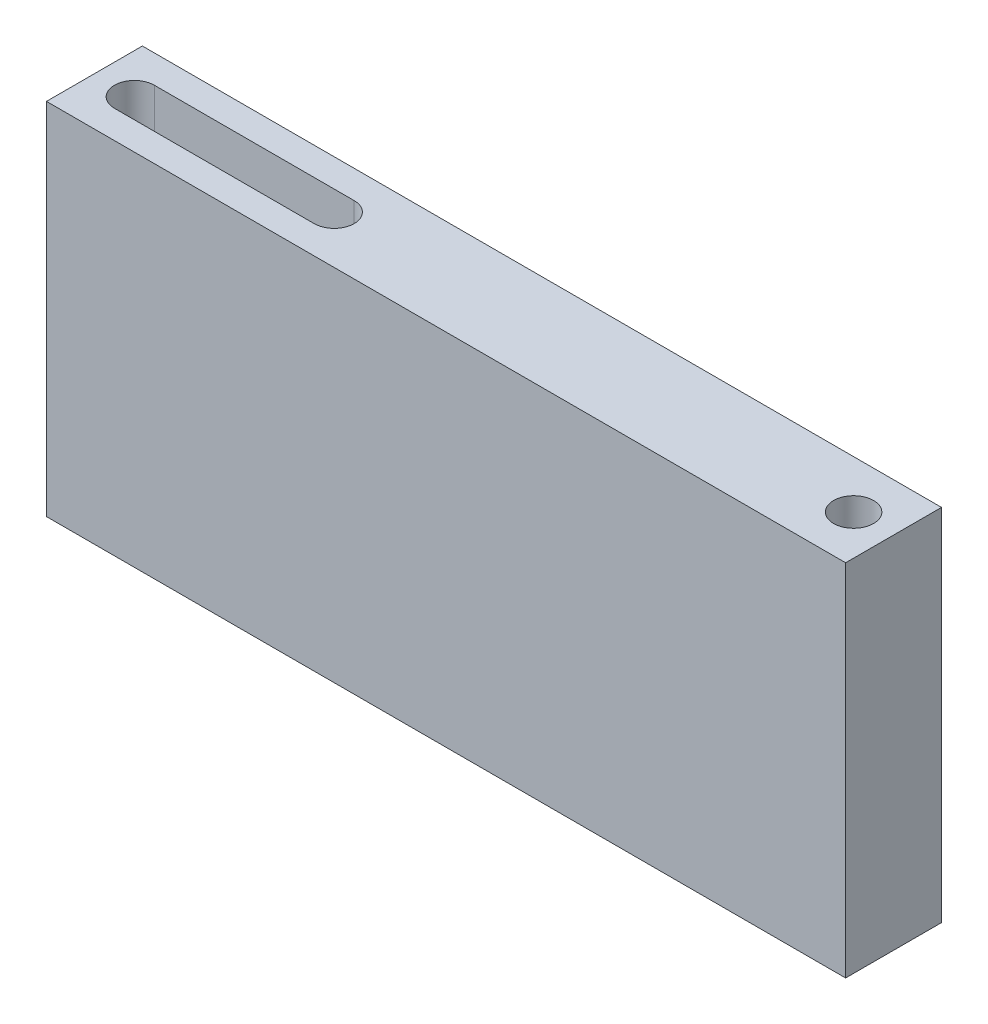
from build123d import *

# Parameters (mm, degrees)
SKETCH3_W           = 100
SKETCH3_H           = 45
BOSS_EXTRUDE2_DEPTH = 12
SKETCH4_R           = 2.5
CUT_EXTRUDE1_DEPTH  = 111.313190508


with BuildPart() as part:
    # Sketch3 → Boss-Extrude2 (new body)
    with BuildSketch(Plane.XY):
        with Locations((50, 22.5)):
            Rectangle(SKETCH3_W, SKETCH3_H)
    extrude(amount=BOSS_EXTRUDE2_DEPTH)

    # Sketch4 → Cut-Extrude1 (cut, through all)
    with BuildSketch(Plane.XZ):
        with Locations(Location((95, 6, 0), (0, 0, 270))):
            Circle(SKETCH4_R)
        with BuildLine():
            Line((30, 3.5), (5, 3.5))
            ThreePointArc((5, 3.5), (2.5, 6), (5, 8.5))
            Line((5, 8.5), (30, 8.5))
            ThreePointArc((30, 8.5), (32.5, 6), (30, 3.5))
        make_face()
    extrude(amount=-CUT_EXTRUDE1_DEPTH, mode=Mode.SUBTRACT)


solid = part.part
